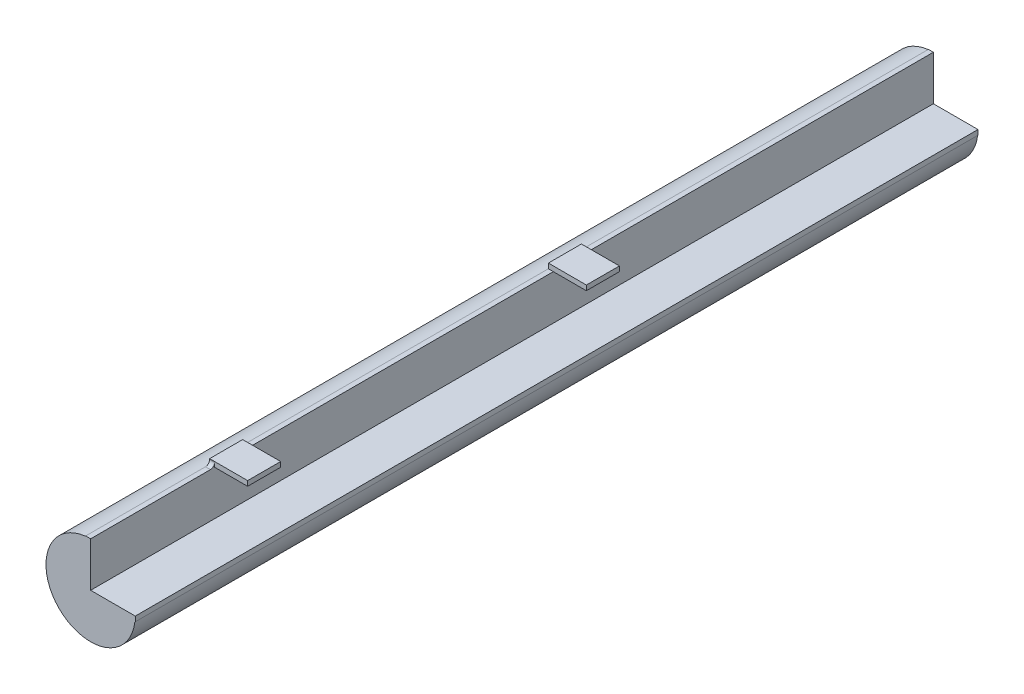
from build123d import *

# Parameters (mm, degrees)
BOSS_EXTRUDE1_DEPTH = 255
SKETCH5_W           = 23
SKETCH5_H           = 20
BOSS_EXTRUDE2_DEPTH = 3
BOSS_EXTRUDE3_DEPTH = 3


with BuildPart() as part:
    # Sketch4 → Boss-Extrude1 (new, symmetric)
    with BuildSketch(Plane.XY):
        with BuildLine():
            Line((0, 0), (27, 0))
            Line((27, 0), (27, -3))
            Line((27, -3), (26.800082477, -3))
            ThreePointArc((26.800082477, -3), (-19.135504983, -19.08508544), (-3, 26.83281573))
            Line((-3, 26.83281573), (-3, 27))
            Line((-3, 27), (0, 27))
            Line((0, 27), (0, 0))
        make_face()
    extrude(amount=BOSS_EXTRUDE1_DEPTH, both=True)

    # Sketch5 → Boss-Extrude2 (add)
    with BuildSketch(Plane(origin=(0, 27, 0), x_dir=(1, 0, 0), z_dir=(0, 1, 0))):
        with Locations((8.5, -170)):
            Rectangle(SKETCH5_W, SKETCH5_H)
        with Locations((8.5, 35)):
            Rectangle(SKETCH5_W, SKETCH5_H)
    extrude(amount=BOSS_EXTRUDE2_DEPTH)

    # Sketch6 → Boss-Extrude3 (add)
    with BuildSketch(Plane(origin=(-3, 27, 180), x_dir=(0, 0, -1), z_dir=(1, 0, 0))):
        with BuildLine():
            ThreePointArc((0, 2.5), (-0.732233047, 0.732233047), (-2.5, 0))
            Line((-2.5, 0), (0, 0))
            Line((0, 0), (0, 2.5))
        make_face()
    extrude(amount=BOSS_EXTRUDE3_DEPTH)


solid = part.part
